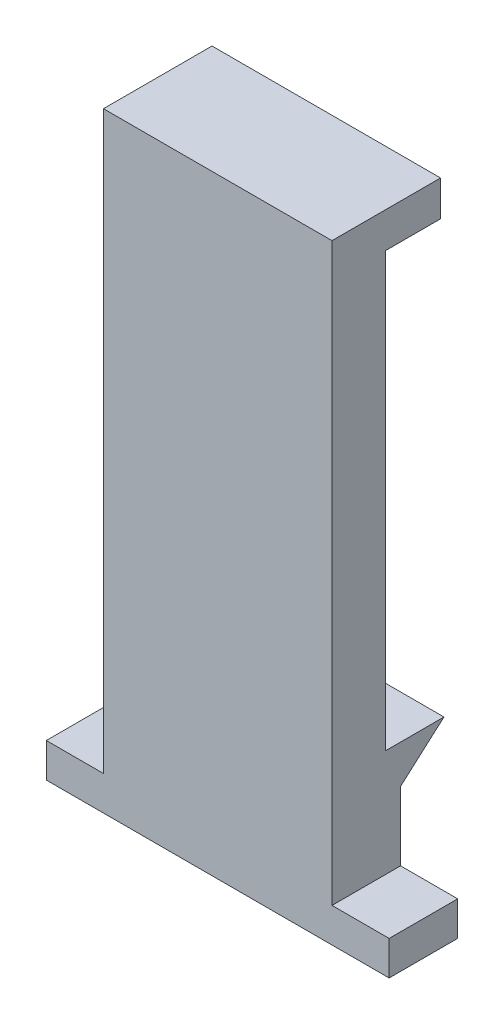
from build123d import *

# Parameters (mm, degrees)
BOSS_EXTRUDE1_DEPTH = 20
SKETCH2_W           = 30
SKETCH2_H           = 6
BOSS_EXTRUDE2_DEPTH = 3


with BuildPart() as part:
    # Sketch1 → Boss-Extrude1 (new body)
    with BuildSketch(Plane(origin=(0, 0, 0), x_dir=(0, 0, -1), z_dir=(1, 0, 0))):
        Polygon((-9.8, -12.38), (-3.8, -12.38), (-3.8, -3.357082066), (0, 0), (-5.1, 0), (-5.1, 37.9), (-0.3, 37.9), (-0.3, 41), (-9.8, 41), align=None)
    extrude(amount=BOSS_EXTRUDE1_DEPTH)

    # Sketch2 → Boss-Extrude2 (add)
    with BuildSketch(Plane.XZ.offset(12.38)):
        with Locations((10, 6.8)):
            Rectangle(SKETCH2_W, SKETCH2_H)
    extrude(amount=-BOSS_EXTRUDE2_DEPTH)


solid = part.part
